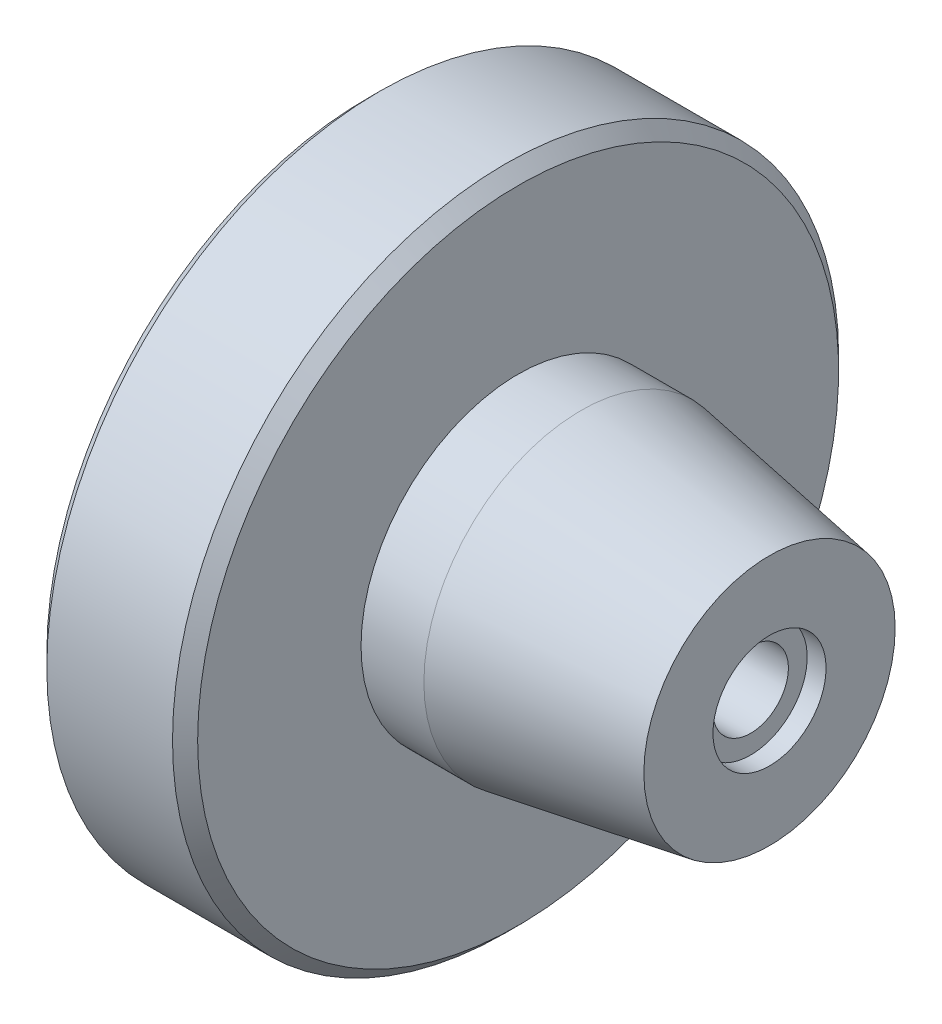
from build123d import *


with BuildPart() as part:
    # 草图1 → 旋转1 (revolve)
    with BuildSketch(Plane.XY, mode=Mode.PRIVATE) as revolve_1_sk:
        Polygon((0, 11.5), (1, 12.5), (8, 12.5), (8, 25.5), (9, 26.5), (19, 26.5), (20, 25.5), (20, 12.5), (25, 12.5), (40, 10), (40, 4.5), (38.5, 4.5), (38.5, 3), (1.5, 3), (1.5, 4.5), (0, 4.5), align=None)
    revolve(revolve_1_sk.sketch.rotate(Axis((0, 0, 0), (1, 0, 0)), 90), axis=Axis((0, 0, 0), (1, 0, 0)))


solid = part.part
